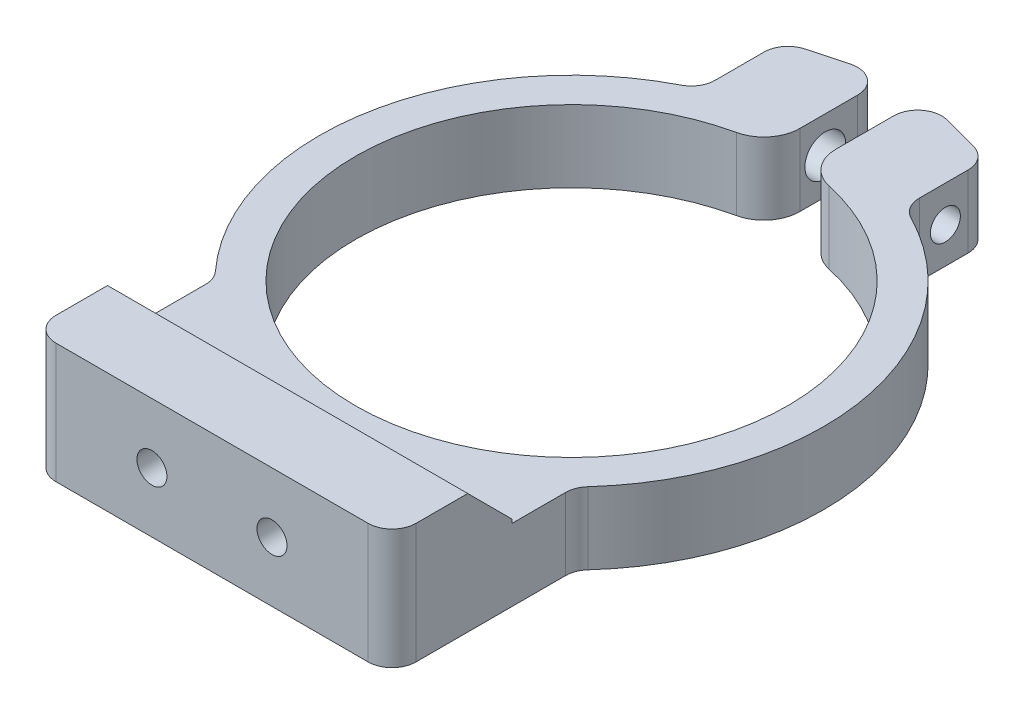
from build123d import *

# Parameters (mm, degrees)
SKETCH_1_R            = 18
EXTRUDE_1_DEPTH       = 6
SKETCH_4_W            = 3
SKETCH_4_H            = 5
CUT_EXTRUDE_2_DEPTH   = 6
SKETCH_20_W           = 30
SKETCH_20_H           = 10
EXTRUDE_6_DEPTH       = 4
EXTRUDE_5_DEPTH       = 6
HOLE_WIZARD_M32_D     = 3.4
HOLE_WIZARD_M32_DEPTH = 7
M3X0_51_D             = 2.5
M3X0_52_D             = 2.5
M3X0_52_DEPTH         = 8.5
M3X0_52_TIP           = 0.751075774
FILLET_1_R            = 2
FILLET_2_R            = 3
CHAMFER_1_SIZE        = 3.7


with BuildPart() as part:
    # Эскиз1 → Бобышка-Вытянуть1 (new body)
    with BuildSketch(Plane(origin=(0, 0, 0), x_dir=(1, 0, 0), z_dir=(0, 1, 0))):
        with BuildLine():
            Line((-15, -14.696938457), (-15, -29.949874371))
            Line((-15, -29.949874371), (15, -29.949874371))
            Line((15, -29.949874371), (15, -14.696938457))
            ThreePointArc((15, -14.696938457), (0, 21), (-15, -14.696938457))
        make_face()
        with Locations(Location((0, 0, 0), (0, 0, 270))):
            Circle(SKETCH_1_R, mode=Mode.SUBTRACT)
    extrude(amount=EXTRUDE_1_DEPTH)

    # Эскиз4 → Вырез-Вытянуть2 (cut)
    with BuildSketch(Plane(origin=(0, 6, 0), x_dir=(1, 0, 0), z_dir=(0, 1, 0))):
        with Locations((0, 18.5)):
            Rectangle(SKETCH_4_W, SKETCH_4_H)
    extrude(amount=-CUT_EXTRUDE_2_DEPTH, mode=Mode.SUBTRACT)

    # Эскиз20 → Бобышка-Вытянуть6 (add)
    with BuildSketch(Plane(origin=(0, 6, 0), x_dir=(1, 0, 0), z_dir=(0, 1, 0))):
        with Locations((0, -24.949874371)):
            Rectangle(SKETCH_20_W, SKETCH_20_H)
    extrude(amount=EXTRUDE_6_DEPTH)

    # Эскиз11 → Бобышка-Вытянуть5 (add)
    with BuildSketch(Plane(origin=(0, 6, 0), x_dir=(1, 0, 0), z_dir=(0, 1, 0))):
        Polygon((-1.5, 17.937391115), (-8.5, 17.937391115), (-8.5, 26.061746768), (-1.5, 27.937391115), align=None)
        Polygon((8.5, 17.937391115), (8.5, 26.061746768), (1.5, 27.937391115), (1.5, 17.937391115), align=None)
    extrude(amount=-EXTRUDE_5_DEPTH)

    # Отверстие с зазором M32
    with Locations(Plane.ZY.offset(8.5)):
        with Locations((-22.632305569, 3)):
            Hole(HOLE_WIZARD_M32_D / 2, depth=HOLE_WIZARD_M32_DEPTH)

    # Отверстие обработанное метчиком M3x0.51 (through all)
    with Locations(Plane(origin=(1.5, -0.91070238, -4.39340032), x_dir=(0, 0, 1), z_dir=(-1, 0, 0))):
        with Locations((-18.238905249, 3.91070238)):
            Hole(M3X0_51_D / 2)

    # Отверстие обработанное метчиком M3x0.52
    with Locations(Plane.XY.offset(29.949874371)):
        with Locations((-5, 5), (5, 5)):
            Hole(M3X0_52_D / 2, depth=M3X0_52_DEPTH)
            with Locations((0, 0, -(M3X0_52_DEPTH + M3X0_52_TIP / 2))):  # 118° drill point
                Cone(0, M3X0_52_D / 2, M3X0_52_TIP, mode=Mode.SUBTRACT)

    # Скругление1
    fillet_1_edges = [part.edges().sort_by_distance(p)[0] for p in [
        (15, 3, 14.696938457),
        (-8.5, 3, -19.20286437),
        (8.5, 3, -19.20286437),
        (15, 5, 29.949874371),
        (-15, 5, 29.949874371),
        (-15, 3, 14.696938457),
        (8.5, 3, -26.061746768),
        (1.5, 3, -27.937391115),
        (-1.5, 3, -27.937391115),
        (-8.5, 3, -26.061746768),
    ]]
    fillet(fillet_1_edges, radius=FILLET_1_R)

    # Скругление2
    fillet_2_edges = [part.edges().sort_by_distance(p)[0] for p in [
        (-1.5, 3, -17.937391115),
        (1.5, 3, -17.937391115),
    ]]
    fillet(fillet_2_edges, radius=FILLET_2_R)

    # Фаска1
    chamfer_1_edges = [part.edges().sort_by_distance(p)[0] for p in [
        (0, 10, 19.949874371),
    ]]
    chamfer(chamfer_1_edges, length=CHAMFER_1_SIZE)


solid = part.part
